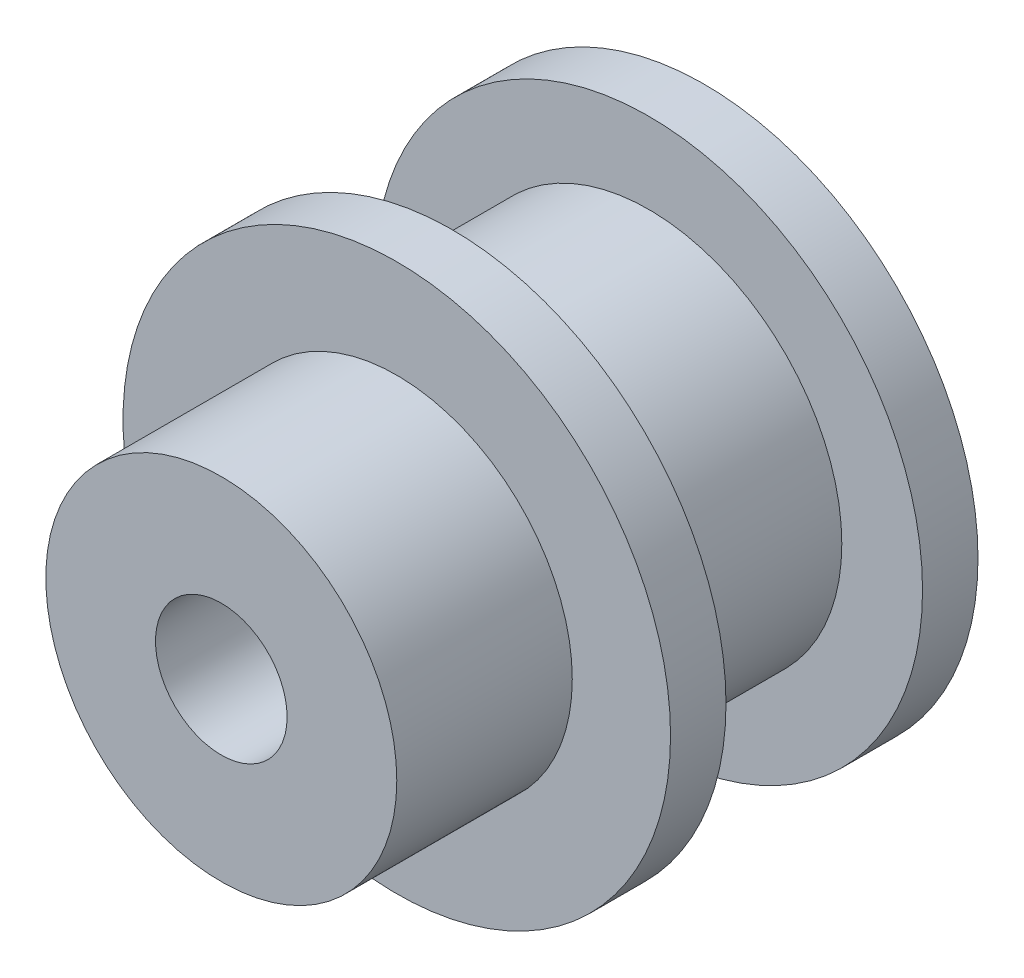
from build123d import *


with BuildPart() as part:
    # Sketch1 → Revolve1 (revolve)
    with BuildSketch(Plane(origin=(0, 0, 0), x_dir=(0, 0, -1), z_dir=(1, 0, 0)), mode=Mode.PRIVATE) as revolve1_sk:
        Polygon((0, 2.38125), (17.4752, 2.38125), (17.4752, 9.906), (15.4686, 9.906), (15.4686, 6.985), (8.3566, 6.985), (8.3566, 9.906), (6.35, 9.906), (6.35, 6.35), (0, 6.35), align=None)
    revolve(revolve1_sk.sketch.rotate(Axis((0, 0, 0), (0, 0, -1)), 90), axis=Axis((0, 0, 0), (0, 0, -1)))


solid = part.part
